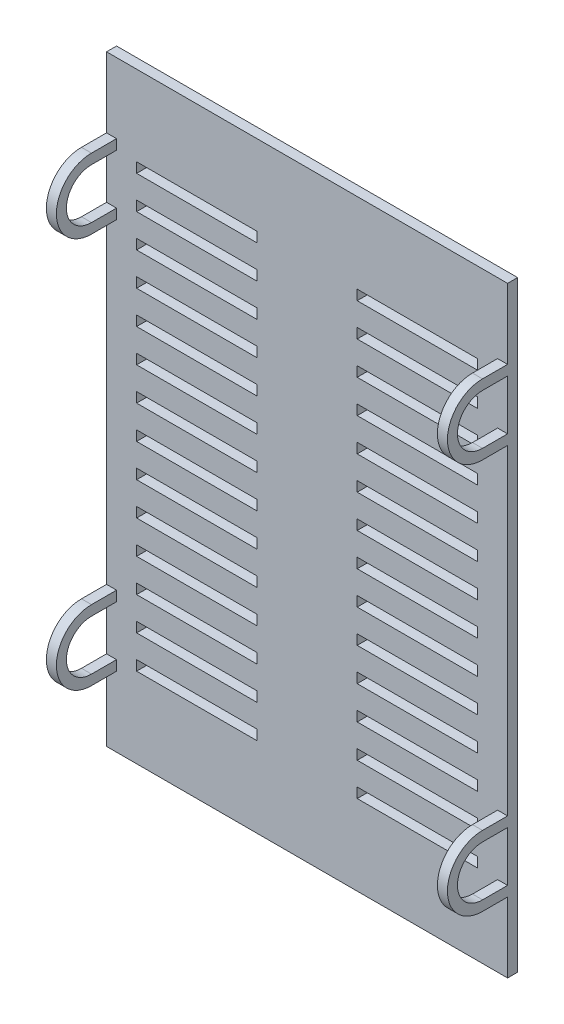
from build123d import *

# Parameters (mm, degrees)
CROQUIS1_W              = 200
CROQUIS1_H              = 300
SALIENTE_EXTRUIR1_DEPTH = 5
CROQUIS2_W              = 60
CROQUIS2_H              = 5
CORTAR_EXTRUIR1_DEPTH   = 181.346887969
EXTRUIR_L_MINA1_DEPTH   = 200
CROQUIS7_W              = 190
CROQUIS7_H              = 272.300046581
CORTAR_EXTRUIR2_DEPTH   = 183.756668825


with BuildPart() as part:
    # Croquis1 → Saliente-Extruir1 (new body)
    with BuildSketch(Plane.XY):
        Rectangle(CROQUIS1_W, CROQUIS1_H)
    extrude(amount=SALIENTE_EXTRUIR1_DEPTH)

    # Croquis2 → Cortar-Extruir1 (cut, through all)
    with BuildSketch(Plane.XY.offset(5)):
        with Locations((-55, 107.5)):
            Rectangle(CROQUIS2_W, CROQUIS2_H)
        with Locations((55, 107.5)):
            Rectangle(CROQUIS2_W, CROQUIS2_H)
        with Locations((55, 90.961538462)):
            Rectangle(CROQUIS2_W, CROQUIS2_H)
        with Locations((55, 74.423076923)):
            Rectangle(CROQUIS2_W, CROQUIS2_H)
        with Locations((55, 57.884615385)):
            Rectangle(CROQUIS2_W, CROQUIS2_H)
        with Locations((55, 41.346153846)):
            Rectangle(CROQUIS2_W, CROQUIS2_H)
        with Locations((55, 24.807692308)):
            Rectangle(CROQUIS2_W, CROQUIS2_H)
        with Locations((55, 8.269230769)):
            Rectangle(CROQUIS2_W, CROQUIS2_H)
        with Locations((55, -8.269230769)):
            Rectangle(CROQUIS2_W, CROQUIS2_H)
        with Locations((55, -24.807692308)):
            Rectangle(CROQUIS2_W, CROQUIS2_H)
        with Locations((55, -41.346153846)):
            Rectangle(CROQUIS2_W, CROQUIS2_H)
        with Locations((55, -57.884615385)):
            Rectangle(CROQUIS2_W, CROQUIS2_H)
        with Locations((55, -74.423076923)):
            Rectangle(CROQUIS2_W, CROQUIS2_H)
        with Locations((55, -90.961538462)):
            Rectangle(CROQUIS2_W, CROQUIS2_H)
        with Locations((55, -107.5)):
            Rectangle(CROQUIS2_W, CROQUIS2_H)
        with Locations((-55, 90.961538462)):
            Rectangle(CROQUIS2_W, CROQUIS2_H)
        with Locations((-55, 74.423076923)):
            Rectangle(CROQUIS2_W, CROQUIS2_H)
        with Locations((-55, 57.884615385)):
            Rectangle(CROQUIS2_W, CROQUIS2_H)
        with Locations((-55, 41.346153846)):
            Rectangle(CROQUIS2_W, CROQUIS2_H)
        with Locations((-55, 24.807692308)):
            Rectangle(CROQUIS2_W, CROQUIS2_H)
        with Locations((-55, 8.269230769)):
            Rectangle(CROQUIS2_W, CROQUIS2_H)
        with Locations((-55, -8.269230769)):
            Rectangle(CROQUIS2_W, CROQUIS2_H)
        with Locations((-55, -24.807692308)):
            Rectangle(CROQUIS2_W, CROQUIS2_H)
        with Locations((-55, -41.346153846)):
            Rectangle(CROQUIS2_W, CROQUIS2_H)
        with Locations((-55, -57.884615385)):
            Rectangle(CROQUIS2_W, CROQUIS2_H)
        with Locations((-55, -74.423076923)):
            Rectangle(CROQUIS2_W, CROQUIS2_H)
        with Locations((-55, -90.961538462)):
            Rectangle(CROQUIS2_W, CROQUIS2_H)
        with Locations((-55, -107.5)):
            Rectangle(CROQUIS2_W, CROQUIS2_H)
    extrude(amount=-CORTAR_EXTRUIR1_DEPTH, mode=Mode.SUBTRACT)

    # Croquis5 → Extruir-Lámina1 (add)
    with BuildSketch(Plane.ZY.offset(100)):
        with BuildLine():
            Line((5, 85), (17.5, 85))
            ThreePointArc((17.5, 85), (30, 97.5), (17.5, 110))
            Line((17.5, 110), (5, 110))
            Line((5, 110), (5, 115))
            Line((5, 115), (17.5, 115))
            ThreePointArc((17.5, 115), (35, 97.5), (17.5, 80))
            Line((17.5, 80), (5, 80))
            Line((5, 80), (5, 85))
        make_face()
        with BuildLine():
            Line((5, -110), (17.5, -110))
            ThreePointArc((17.5, -110), (30, -97.5), (17.5, -85))
            Line((17.5, -85), (5, -85))
            Line((5, -85), (5, -80))
            Line((5, -80), (17.5, -80))
            ThreePointArc((17.5, -80), (35, -97.5), (17.5, -115))
            Line((17.5, -115), (5, -115))
            Line((5, -115), (5, -110))
        make_face()
    extrude(amount=-EXTRUIR_L_MINA1_DEPTH)

    # Croquis7 → Cortar-Extruir2 (cut, through all)
    with BuildSketch(Plane.XY.offset(5)):
        with Locations((0, 8.640872113)):
            Rectangle(CROQUIS7_W, CROQUIS7_H)
    extrude(amount=CORTAR_EXTRUIR2_DEPTH, mode=Mode.SUBTRACT)


solid = part.part
